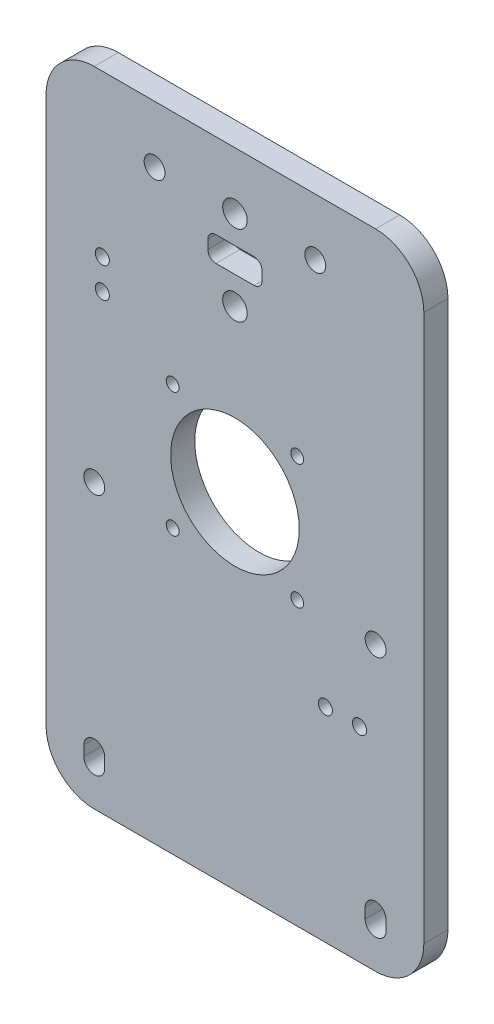
from build123d import *

# Parameters (mm, degrees)
MODEL_R                         = 16
MODEL_R_2                       = 3.05
MODEL_R_3                       = 2.6
MODEL_W                         = 13.5
MODEL_H                         = 6.2
BASE_DEPTH                      = 6
SKETCH1_R                       = 1.75
SENSORMOUNT_DEPTH               = 167.868211472
SKETCH2_R                       = 1.75
CABLEMOUNT_DEPTH                = 10
FILLETCABLESLOT_R               = 2
F_3_2_3_2_STEPPER_MOUNT_HOLES_D = 3.2


with BuildPart() as part:
    # Model → Base (new body)
    with BuildSketch(Plane.XY):
        with BuildLine():
            Line((-35, 160), (35, 160))
            ThreePointArc((35, 160), (43.485281374, 156.485281374), (47, 148))
            Line((47, 148), (47, 12))
            ThreePointArc((47, 12), (43.485281374, 3.514718626), (35, 0))
            Line((35, 0), (-35, 0))
            ThreePointArc((-35, 0), (-43.485281374, 3.514718626), (-47, 12))
            Line((-47, 12), (-47, 148))
            ThreePointArc((-47, 148), (-43.485281374, 156.485281374), (-35, 160))
        make_face()
        with Locations((0, 85.8)):
            Circle(MODEL_R, mode=Mode.SUBTRACT)
        with Locations((0, 145.8)):
            Circle(MODEL_R_2, mode=Mode.SUBTRACT)
        with Locations((-20, 145.8)):
            Circle(MODEL_R_3, mode=Mode.SUBTRACT)
        with Locations((20, 145.8)):
            Circle(MODEL_R_3, mode=Mode.SUBTRACT)
        with Locations((-35, 70.45)):
            Circle(MODEL_R_3, mode=Mode.SUBTRACT)
        with Locations((0, 125.8)):
            Circle(MODEL_R_2, mode=Mode.SUBTRACT)
        with Locations((35, 70.45)):
            Circle(MODEL_R_3, mode=Mode.SUBTRACT)
        with BuildLine():
            Line((-32.4, 12.5), (-32.4, 10))
            ThreePointArc((-32.4, 10), (-35, 7.4), (-37.6, 10))
            Line((-37.6, 10), (-37.6, 12.5))
            ThreePointArc((-37.6, 12.5), (-35, 15.1), (-32.4, 12.5))
        make_face(mode=Mode.SUBTRACT)
        with BuildLine():
            Line((32.4, 12.5), (32.4, 10))
            ThreePointArc((32.4, 10), (35, 7.4), (37.6, 10))
            Line((37.6, 10), (37.6, 12.5))
            ThreePointArc((37.6, 12.5), (35, 15.1), (32.4, 12.5))
        make_face(mode=Mode.SUBTRACT)
        with Locations((0, 135.8)):
            Rectangle(MODEL_W, MODEL_H, mode=Mode.SUBTRACT)
    extrude(amount=BASE_DEPTH)

    # Sketch1 → SensorMount (cut, through all)
    with BuildSketch(Plane.XY.offset(6)):
        with Locations((-33, 120)):
            Circle(SKETCH1_R)
        with Locations((-33, 112.5)):
            Circle(SKETCH1_R)
    extrude(amount=-SENSORMOUNT_DEPTH, mode=Mode.SUBTRACT)

    # Sketch2 → CableMount (cut)
    with BuildSketch(Plane.XY.offset(6)):
        with Locations((22.5, 50.76)):
            Circle(SKETCH2_R)
        with Locations((31, 50.76)):
            Circle(SKETCH2_R)
    extrude(amount=-CABLEMOUNT_DEPTH, mode=Mode.SUBTRACT)

    # FilletCableSlot
    filletcableslot_edges = [part.edges().sort_by_distance(p)[0] for p in [
        (6.75, 138.9, 3),
        (-6.75, 138.9, 3),
        (-6.75, 132.7, 3),
        (6.75, 132.7, 3),
    ]]
    fillet(filletcableslot_edges, radius=FILLETCABLESLOT_R)

    # Ø3.2 (3.2) Stepper mount Holes (through all)
    with Locations(Plane.XY.offset(6)):
        with Locations((-15.5, 101.3), (-15.5, 70.3), (15.5, 70.3), (15.5, 101.3)):
            Hole(F_3_2_3_2_STEPPER_MOUNT_HOLES_D / 2)


solid = part.part
